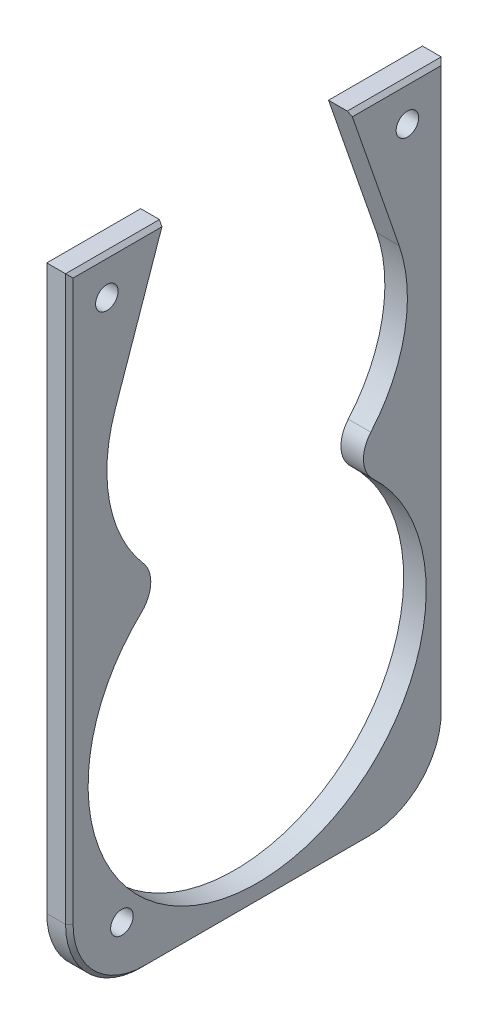
from build123d import *

# Parameters (mm, degrees)
SKETCH_1_W          = 50
SKETCH_1_H          = 85
EXTRUDE_1_DEPTH     = 3
FILLET_2_R          = 10
SKETCH_4_R          = 1.5
CUT_EXTRUDE_1_DEPTH = 3
CHAMFER_1_SIZE      = 0.5
CUT_EXTRUDE_3_DEPTH = 3
SKETCH_7_R          = 22.5
CUT_EXTRUDE_4_DEPTH = 3
FILLET_4_R          = 4


with BuildPart() as part:
    # 草图1 → 凸台-拉伸1 (new body)
    with BuildSketch(Plane(origin=(0, 0, 0), x_dir=(0, 0, -1), z_dir=(1, 0, 0))):
        with Locations((0, 7.5)):
            Rectangle(SKETCH_1_W, SKETCH_1_H)
    extrude(amount=EXTRUDE_1_DEPTH)

    # 圆角2
    fillet_2_edges = [part.edges().sort_by_distance(p)[0] for p in [
        (1.5, -35, -25),
        (1.5, -35, 25),
    ]]
    fillet(fillet_2_edges, radius=FILLET_2_R)

    # 草图4 → 切除-拉伸1 (cut)
    with BuildSketch(Plane(origin=(3, 0, 0), x_dir=(0, 0, -1), z_dir=(1, 0, 0))):
        with Locations((20, 45)):
            Circle(SKETCH_4_R)
        with Locations((-20, 45)):
            Circle(SKETCH_4_R)
        with Locations((-18, -28)):
            Circle(SKETCH_4_R)
    extrude(amount=-CUT_EXTRUDE_1_DEPTH, mode=Mode.SUBTRACT)

    # 倒角1
    chamfer_1_edges = [part.edges().sort_by_distance(p)[0] for p in [
        (3, 12.5, -25),
        (3, 50, 0),
        (3, -35, 0),
        (3, -32.071067812, 22.071067812),
        (3, -32.071067812, -22.071067812),
        (3, 12.5, 25),
    ]]
    chamfer(chamfer_1_edges, length=CHAMFER_1_SIZE)

    # 草图6 → 切除-拉伸3 (cut)
    with BuildSketch(Plane(origin=(3, 0, 0), x_dir=(0, 0, -1), z_dir=(1, 0, 0))):
        with BuildLine():
            Line((-12.5, 50), (12.5, 50))
            Line((12.5, 50), (18.896399481, 31.551800259))
            ThreePointArc((18.896399481, 31.551800259), (0, 5), (-18.896399481, 31.551800259))
            Line((-18.896399481, 31.551800259), (-12.5, 50))
        make_face()
    extrude(amount=-CUT_EXTRUDE_3_DEPTH, mode=Mode.SUBTRACT)

    # 草图7 → 切除-拉伸4 (cut)
    with BuildSketch(Plane(origin=(3, 0, 0), x_dir=(0, 0, -1), z_dir=(1, 0, 0))):
        with Locations((0, -10)):
            Circle(SKETCH_7_R)
    extrude(amount=-CUT_EXTRUDE_4_DEPTH, mode=Mode.SUBTRACT)

    # 圆角4
    fillet_4_edges = [part.edges().sort_by_distance(p)[0] for p in [
        (1.5, 9.017857143, 12.02377269),
        (1.5, 9.017857143, -12.02377269),
    ]]
    fillet(fillet_4_edges, radius=FILLET_4_R)


solid = part.part
